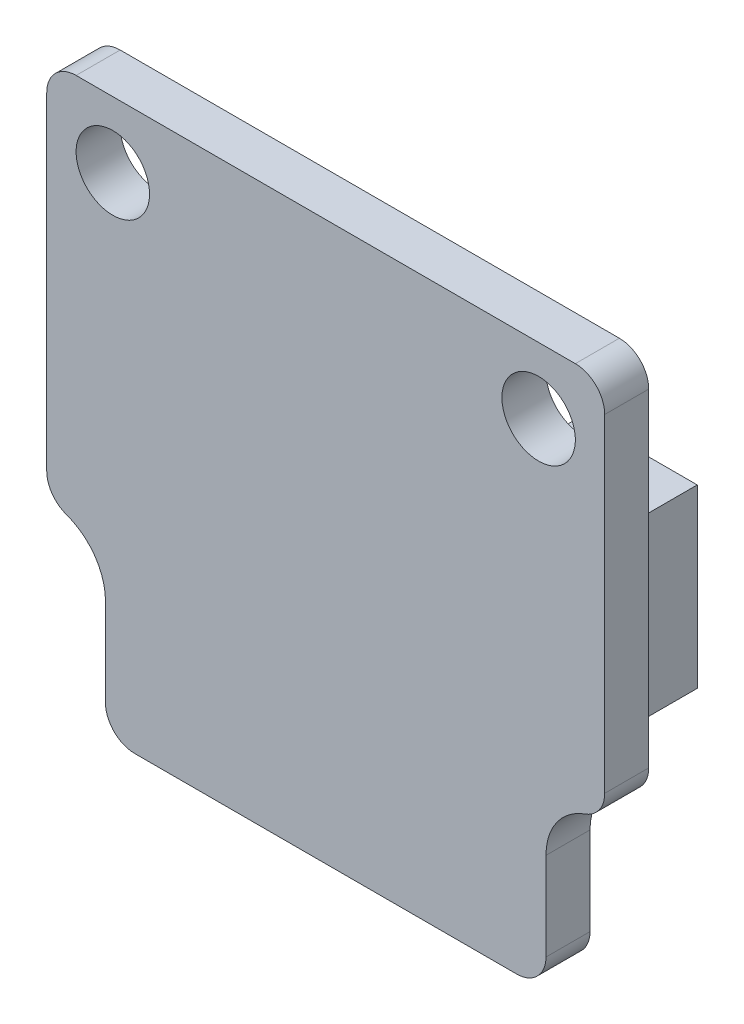
from build123d import *

# Parameters (mm, degrees)
BOSS_EXTRUDE1_DEPTH = 1.5
SKETCH2_R           = 1.25
CUT_EXTRUDE1_DEPTH  = 27.911893282
SKETCH3_W           = 4
SKETCH3_H           = 6
BOSS_EXTRUDE2_DEPTH = 3
SKETCH4_W           = 0.314102564
SKETCH4_H           = 3.5
CUT_EXTRUDE2_DEPTH  = 0.5


with BuildPart() as part:
    # Sketch1 → Boss-Extrude1 (new body)
    with BuildSketch(Plane.XY):
        with BuildLine():
            Line((3, 0), (16, 0))
            ThreePointArc((16, 0), (16.707106781, 0.292893219), (17, 1))
            Line((17, 1), (17, 4))
            ThreePointArc((17, 4), (17.367006838, 5.154700538), (18.333333333, 5.885618083))
            ThreePointArc((18.333333333, 5.885618083), (18.816496581, 6.251076856), (19, 6.828427125))
            Line((19, 6.828427125), (19, 18))
            ThreePointArc((19, 18), (18.707106781, 18.707106781), (18, 19))
            Line((18, 19), (1, 19))
            ThreePointArc((1, 19), (0.292893219, 18.707106781), (0, 18))
            Line((0, 18), (0, 6.828427125))
            ThreePointArc((0, 6.828427125), (0.183503419, 6.251076856), (0.666666667, 5.885618083))
            ThreePointArc((0.666666667, 5.885618083), (1.632993162, 5.154700538), (2, 4))
            Line((2, 4), (2, 1))
            ThreePointArc((2, 1), (2.292893219, 0.292893219), (3, 0))
        make_face()
    extrude(amount=BOSS_EXTRUDE1_DEPTH)

    # Sketch2 → Cut-Extrude1 (cut, through all)
    with BuildSketch(Plane(origin=(0, 0, 0), x_dir=(-1, 0, 0), z_dir=(0, 0, -1))):
        with Locations((-16.75, 16.75)):
            Circle(SKETCH2_R)
    cut_extrude1 = extrude(amount=-CUT_EXTRUDE1_DEPTH, mode=Mode.SUBTRACT)

    # Mirror1: Cut-Extrude1 across plane
    add(cut_extrude1.mirror(Plane.ZY.offset(-9.5)), mode=Mode.SUBTRACT)

    # Sketch3 → Boss-Extrude2 (add)
    with BuildSketch(Plane(origin=(0, 0, 0), x_dir=(-1, 0, 0), z_dir=(0, 0, -1))):
        with Locations((-15.652122357, 10)):
            Rectangle(SKETCH3_W, SKETCH3_H)
    extrude(amount=BOSS_EXTRUDE2_DEPTH)

    # Sketch4 → Cut-Extrude2 (cut)
    with BuildSketch(Plane(origin=(0, 0, 0), x_dir=(-1, 0, 0), z_dir=(0, 0, -1))):
        with Locations((-14.095226395, 2.323572114)):
            Rectangle(SKETCH4_W, SKETCH4_H)
        Polygon((-13.220226395, 0.573572114), (-12.758187132, 4.073572114), (-12.713315337, 4.073572114), (-11.268303318, 1.201777242), (-9.82749803, 4.073572114), (-9.782626235, 4.073572114), (-9.316380241, 0.573572114), (-9.630482805, 0.573572114), (-9.967021267, 3.089898236), (-11.229741619, 0.573572114), (-11.301256042, 0.573572114), (-12.569585369, 3.097610576), (-12.904020466, 0.573572114), align=None)
        with BuildLine():
            Line((-8.598431523, 4.073572114), (-8.284328959, 4.073572114))
            Line((-8.284328959, 4.073572114), (-8.284328959, 1.976516826))
            add(Edge.make_bspline(
                [(-8.284328959, 1.976516826), (-8.284375703, 1.94683609), (-8.284464408, 1.890511779), (-8.283871894, 1.810343478), (-8.282212526, 1.739071019), (-8.281166366, 1.676419672), (-8.278839032, 1.622676924), (-8.276940986, 1.577551614), (-8.274500429, 1.541257411), (-8.271567311, 1.520076485), (-8.270306523, 1.510971954)],
                knots=[0, 0, 0, 0, 1.528628734, 2.90083645, 4.128790002, 5.200304208, 6.127813768, 6.898992206, 7.526736466, 8, 8, 8, 8], degree=3))
            add(Edge.make_bspline(
                [(-8.270306523, 1.510971954), (-8.265129064, 1.478125191), (-8.255065878, 1.414282461), (-8.2294195, 1.32337418), (-8.193601999, 1.241442721), (-8.151158957, 1.16593143), (-8.095226345, 1.09894207), (-8.02822281, 1.037230417), (-7.947045041, 0.983258613), (-7.856784436, 0.933907801), (-7.759499198, 0.894242719), (-7.660087932, 0.864249354), (-7.560044953, 0.845970454), (-7.493068788, 0.843853915), (-7.459809728, 0.842802883)],
                knots=[0, 0, 0, 0, 1.035780045, 2.013197591, 2.933192213, 3.817615948, 4.702609284, 5.640816605, 6.646850145, 7.73207398, 8.84249596, 9.914020372, 10.964143139, 12, 12, 12, 12], degree=3))
            add(Edge.make_bspline(
                [(-7.459809728, 0.842802883), (-7.431255988, 0.843876734), (-7.374313426, 0.846018232), (-7.289706995, 0.859279663), (-7.207306887, 0.883180229), (-7.126706207, 0.914019987), (-7.051155222, 0.954767578), (-6.98061178, 1.001838418), (-6.917647846, 1.057049294), (-6.860189848, 1.118149638), (-6.810154912, 1.187089438), (-6.766783771, 1.262367576), (-6.731257841, 1.345116923), (-6.713714316, 1.403271345), (-6.704701555, 1.433147435)],
                knots=[0, 0, 0, 0, 0.994687771, 1.983630487, 2.973142513, 3.978332533, 4.983357753, 5.956394766, 6.925816176, 7.893390482, 8.871859704, 9.88551698, 10.913711441, 12, 12, 12, 12], degree=3))
            add(Edge.make_bspline(
                [(-6.704701555, 1.433147435), (-6.70170143, 1.445496009), (-6.695015942, 1.473013609), (-6.688768897, 1.5195349), (-6.682262371, 1.574424264), (-6.677747801, 1.638076076), (-6.673346581, 1.710277049), (-6.670713508, 1.791403307), (-6.669496475, 1.881160267), (-6.669133795, 1.943797429), (-6.668944344, 1.976516826)],
                knots=[0, 0, 0, 0, 0.558680831, 1.244966039, 2.062412453, 2.990489873, 4.051219941, 5.244515665, 6.560634259, 8, 8, 8, 8], degree=3))
            Line((-6.668944344, 1.976516826), (-6.668944344, 4.073572114))
            Line((-6.668944344, 4.073572114), (-6.35484178, 4.073572114))
            Line((-6.35484178, 4.073572114), (-6.35484178, 1.959689903))
            add(Edge.make_bspline(
                [(-6.35484178, 1.959689903), (-6.3550959, 1.921591524), (-6.355591831, 1.847240221), (-6.359892408, 1.738288862), (-6.366749408, 1.63493588), (-6.376437496, 1.537167384), (-6.389274499, 1.445333225), (-6.403549719, 1.358628457), (-6.421729252, 1.277675464), (-6.442962654, 1.201843046), (-6.467236202, 1.129657533), (-6.49867735, 1.061148918), (-6.53410185, 0.994234519), (-6.576116503, 0.92992641), (-6.623327885, 0.867939856), (-6.676779566, 0.808650781), (-6.734703727, 0.751111735), (-6.798063287, 0.696798669), (-6.865813812, 0.646989992), (-6.93775377, 0.603192221), (-7.013330539, 0.566168604), (-7.092347666, 0.535692679), (-7.174838868, 0.51277808), (-7.260806228, 0.495702924), (-7.350445421, 0.486000627), (-7.411410078, 0.484558697), (-7.442281683, 0.483828524)],
                knots=[0, 0, 0, 0, 1.316592851, 2.569410997, 3.76748051, 4.895814652, 5.963796859, 6.97159953, 7.931736103, 8.829262218, 9.692595152, 10.560224239, 11.431080259, 12.30701507, 13.211635791, 14.121146779, 15.063487852, 16.031507147, 17.00238618, 17.966455255, 18.938106653, 19.907068911, 20.888905087, 21.893141452, 22.933117798, 24, 24, 24, 24], degree=3))
            add(Edge.make_bspline(
                [(-7.442281683, 0.483828524), (-7.475950786, 0.48461329), (-7.542009445, 0.486152996), (-7.639347512, 0.494975746), (-7.732661709, 0.511594141), (-7.822937586, 0.532754085), (-7.908946083, 0.561937822), (-7.991839527, 0.596035947), (-8.070198208, 0.637913207), (-8.145293337, 0.6845066), (-8.215118093, 0.736931238), (-8.279215496, 0.794071412), (-8.337691367, 0.855011789), (-8.389560063, 0.920412155), (-8.435680948, 0.989763862), (-8.475411161, 1.063263102), (-8.509524405, 1.140881418), (-8.527130972, 1.194834619), (-8.536031683, 1.222109774)],
                knots=[0, 0, 0, 0, 1.13879206, 2.234305948, 3.301075583, 4.341971843, 5.366689343, 6.369221514, 7.369726634, 8.367512178, 9.355451585, 10.318319045, 11.268648973, 12.207971039, 13.137398894, 14.081662264, 15.030215811, 16, 16, 16, 16], degree=3))
            add(Edge.make_bspline(
                [(-8.536031683, 1.222109774), (-8.541208842, 1.240742349), (-8.552438213, 1.281156818), (-8.564463511, 1.348043306), (-8.574572592, 1.425058224), (-8.584078151, 1.512206842), (-8.589687108, 1.609556709), (-8.594604547, 1.717065625), (-8.598466166, 1.834863587), (-8.598443394, 1.916918102), (-8.598431523, 1.959689903)],
                knots=[0, 0, 0, 0, 0.625038921, 1.35572334, 2.194682327, 3.136881307, 4.189498639, 5.346923369, 6.617055217, 8, 8, 8, 8], degree=3))
            Line((-8.598431523, 1.959689903), (-8.598431523, 4.073572114))
        make_face()
    extrude(amount=-CUT_EXTRUDE2_DEPTH, mode=Mode.SUBTRACT)


solid = part.part
